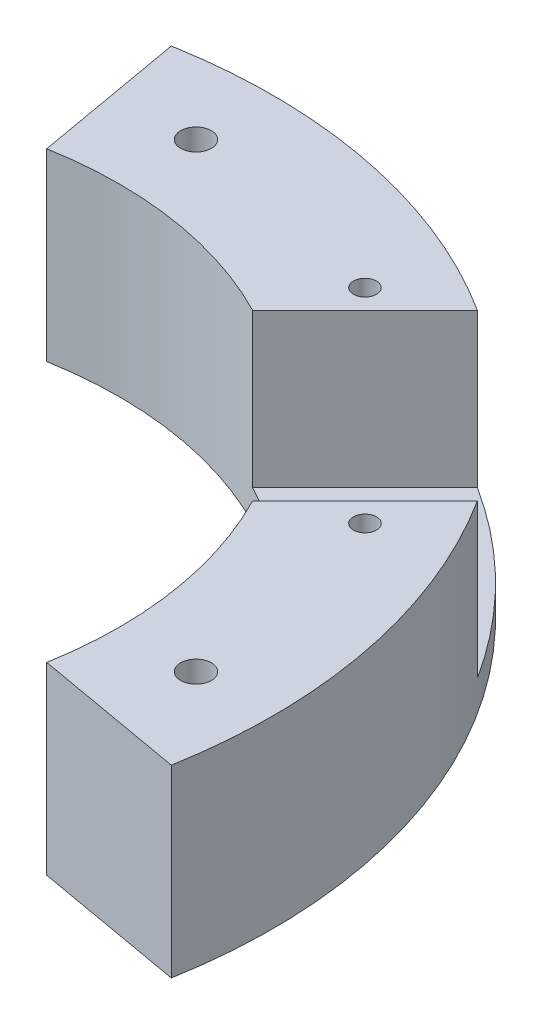
from build123d import *

# Parameters (mm, degrees)
SKETCH1_R           = 2.5
BOSS_EXTRUDE1_DEPTH = 30
CUT_EXTRUDE1_START  = -25
CUT_EXTRUDE1_DEPTH  = 25
SKETCH3_R           = 1.875
CUT_EXTRUDE2_DEPTH  = 128.328315782


with BuildPart() as part:
    # Sketch1 → Boss-Extrude1 (new body)
    with BuildSketch(Plane(origin=(0, 0, 0), x_dir=(1, 0, 0), z_dir=(0, 1, 0))):
        with BuildLine():
            Line((-10.853011104, 61.550484563), (-15.194215546, 86.170678389))
            ThreePointArc((-15.194215546, 86.170678389), (61.871843354, 61.871843354), (86.170678389, -15.194215546))
            Line((86.170678389, -15.194215546), (61.550484563, -10.853011104))
            ThreePointArc((61.550484563, -10.853011104), (44.194173824, 44.194173824), (-10.853011104, 61.550484563))
        make_face()
        with Locations(Location((75, 0, 0), (0, 0, 270))):
            Circle(SKETCH1_R, mode=Mode.SUBTRACT)
        with Locations(Location((0, 75, 0), (0, 0, 270))):
            Circle(SKETCH1_R, mode=Mode.SUBTRACT)
    extrude(amount=BOSS_EXTRUDE1_DEPTH)

    # Sketch2 → Cut-Extrude1 (cut)
    with BuildSketch(Plane(origin=(0, 30, 0), x_dir=(1, 0, 0), z_dir=(0, 1, 0)).offset(CUT_EXTRUDE1_START)):
        with BuildLine():
            Line((28.667524524, 55.537582209), (46.960542187, 73.830599872))
            ThreePointArc((46.960542187, 73.830599872), (61.871843354, 61.871843354), (73.830599872, 46.960542187))
            Line((73.830599872, 46.960542187), (55.537582209, 28.667524524))
            ThreePointArc((55.537582209, 28.667524524), (44.194173824, 44.194173824), (28.667524524, 55.537582209))
        make_face()
    extrude(amount=CUT_EXTRUDE1_DEPTH, mode=Mode.SUBTRACT)

    # Sketch3 → Cut-Extrude2 (cut, through all)
    with BuildSketch(Plane(origin=(0, 30, 0), x_dir=(1, 0, 0), z_dir=(0, 1, 0))):
        with Locations(Location((67.866071556, 34.63205284, 0), (0, 0, 270))):
            Circle(SKETCH3_R)
        with Locations(Location((34.63205284, 67.866071556, 0), (0, 0, 270))):
            Circle(SKETCH3_R)
    extrude(amount=-CUT_EXTRUDE2_DEPTH, mode=Mode.SUBTRACT)


solid = part.part
